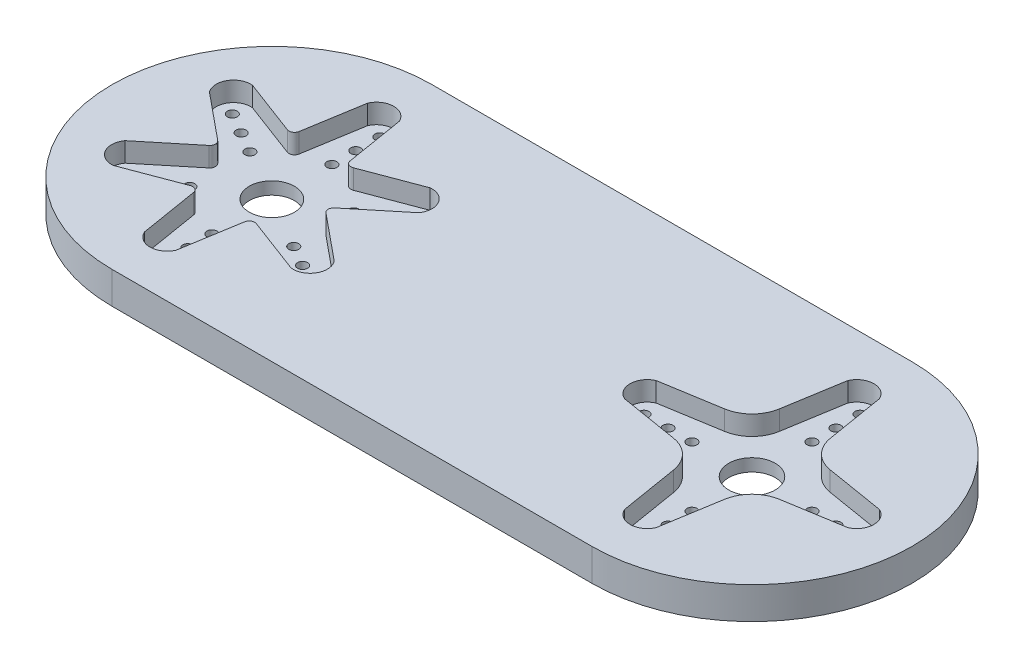
from build123d import *

# Parameters (mm, degrees)
BOSS_EXTRUDE1_DEPTH     = 4
SKETCH2_R               = 0.62500002
CUT_EXTRUDE1_DEPTH      = 2.44
CUT_EXTRUDE3_DEPTH      = 54.906897466
CUT_EXTRUDE3_DEPTH_BACK = 54.906897466
SKETCH3_R               = 0.62500002
SKETCH3_R_2             = 2.819999948
SKETCH3_R_3             = 2.899999788


with BuildPart() as part:
    # Sketch1 → Boss-Extrude1 (new body)
    with BuildSketch(Plane(origin=(0, 0, 0), x_dir=(1, 0, 0), z_dir=(0, 1, 0))):
        with BuildLine():
            Line((-29.999999944, 20), (29.999999944, 20))
            ThreePointArc((29.999999944, 20), (49.999999944, 0), (29.999999944, -20))
            Line((29.999999944, -20), (-29.999999944, -20))
            ThreePointArc((-29.999999944, -20), (-49.999999944, 0), (-29.999999944, 20))
        make_face()
    extrude(amount=BOSS_EXTRUDE1_DEPTH)

    # Sketch2 → Cut-Extrude1 (cut)
    # profile 1 of 2: a face of its own
    with BuildSketch(Plane(origin=(0, 4, 0), x_dir=(1, 0, 0), z_dir=(0, 1, 0))):
        with BuildLine():
            ThreePointArc((-25.922132216, 6.078589696), (-26.51895884, 6.127411318), (-26.859652917, 6.619867525))
            Line((-26.859652917, 6.619867525), (-28.07063938, 13.972272054))
            ThreePointArc((-28.07063938, 13.972272054), (-30.044051051, 15.261772506), (-32.017462722, 13.972272054))
            Line((-32.017462722, 13.972272054), (-33.228449185, 6.619867525))
            ThreePointArc((-33.228449185, 6.619867525), (-33.569143262, 6.127411318), (-34.165969886, 6.078589696))
            Line((-34.165969886, 6.078589696), (-41.138832219, 8.70604692))
            ThreePointArc((-41.138832219, 8.70604692), (-43.242278204, 7.641772507), (-43.112243889, 5.287997642))
            Line((-43.112243889, 5.287997642), (-37.35036802, 0.563050336))
            ThreePointArc((-37.35036802, 0.563050336), (-37.094235473, 0.021772507), (-37.35036802, -0.519505322))
            Line((-37.35036802, -0.519505322), (-43.112243889, -5.244452627))
            ThreePointArc((-43.112243889, -5.244452627), (-43.242278204, -7.598227492), (-41.138832218, -8.662501905))
            Line((-41.138832218, -8.662501905), (-34.165969886, -6.035044681))
            ThreePointArc((-34.165969886, -6.035044681), (-33.569143262, -6.083866304), (-33.228449185, -6.57632251))
            Line((-33.228449185, -6.57632251), (-32.017462722, -13.928727039))
            ThreePointArc((-32.017462722, -13.928727039), (-30.044051051, -15.218227491), (-28.07063938, -13.928727039))
            Line((-28.07063938, -13.928727039), (-26.859652917, -6.576322511))
            ThreePointArc((-26.859652917, -6.576322511), (-26.51895884, -6.083866304), (-25.922132216, -6.035044681))
            Line((-25.922132216, -6.035044681), (-18.949269883, -8.662501905))
            ThreePointArc((-18.949269883, -8.662501905), (-16.845823898, -7.598227492), (-16.975858213, -5.244452627))
            Line((-16.975858213, -5.244452627), (-22.737734082, -0.519505322))
            ThreePointArc((-22.737734082, -0.519505322), (-22.993866629, 0.021772507), (-22.737734082, 0.563050336))
            Line((-22.737734082, 0.563050336), (-16.975858213, 5.287997642))
            ThreePointArc((-16.975858213, 5.287997642), (-16.845823898, 7.641772507), (-18.949269884, 8.70604692))
            Line((-18.949269884, 8.70604692), (-25.922132216, 6.078589696))
        make_face()
    # profile 2 of 2: a face of its own
    with BuildSketch(Plane(origin=(0, 4, 0), x_dir=(1, 0, 0), z_dir=(0, 1, 0))):
        with BuildLine():
            ThreePointArc((33.184398078, -6.598095019), (34.342465035, -4.342465091), (36.598094963, -3.184398134))
            Line((36.598094963, -3.184398134), (43.950499492, -1.973411671))
            ThreePointArc((43.950499492, -1.973411671), (45.239999942, 1e-09), (43.950499491, 1.973411671))
            Line((43.950499491, 1.973411671), (36.598094963, 3.184398134))
            ThreePointArc((36.598094963, 3.184398134), (34.342465035, 4.342465091), (33.184398078, 6.598095019))
            Line((33.184398078, 6.598095019), (31.973411615, 13.950499548))
            ThreePointArc((31.973411615, 13.950499548), (29.999999943, 15.239999998), (28.026588273, 13.950499547))
            Line((28.026588273, 13.950499547), (26.81560181, 6.598095019))
            ThreePointArc((26.81560181, 6.598095019), (25.657534853, 4.342465091), (23.401904925, 3.184398134))
            Line((23.401904925, 3.184398134), (16.049500396, 1.973411671))
            ThreePointArc((16.049500396, 1.973411671), (14.759999946, -1e-09), (16.049500397, -1.973411671))
            Line((16.049500397, -1.973411671), (23.401904925, -3.184398134))
            ThreePointArc((23.401904925, -3.184398134), (25.657534853, -4.342465091), (26.81560181, -6.598095019))
            Line((26.81560181, -6.598095019), (28.026588273, -13.950499548))
            ThreePointArc((28.026588273, -13.950499548), (29.999999945, -15.239999998), (31.973411615, -13.950499547))
            Line((31.973411615, -13.950499547), (33.184398078, -6.598095019))
        make_face()
        with Locations((29.999999944, -13.500466522)):
            Circle(SKETCH2_R, mode=Mode.SUBTRACT)
        with Locations((29.999999944, -10.500466426)):
            Circle(SKETCH2_R, mode=Mode.SUBTRACT)
        with Locations((16.499533422, 0)):
            Circle(SKETCH2_R, mode=Mode.SUBTRACT)
        with Locations((19.499533518, 0)):
            Circle(SKETCH2_R, mode=Mode.SUBTRACT)
        with Locations((22.499533614, 0)):
            Circle(SKETCH2_R, mode=Mode.SUBTRACT)
        with Locations((29.999999944, -7.50046633)):
            Circle(SKETCH2_R, mode=Mode.SUBTRACT)
        with Locations((37.500466274, 0)):
            Circle(SKETCH2_R, mode=Mode.SUBTRACT)
        with Locations((40.50046637, 0)):
            Circle(SKETCH2_R, mode=Mode.SUBTRACT)
        with Locations((43.500466466, 0)):
            Circle(SKETCH2_R, mode=Mode.SUBTRACT)
        with Locations((29.999999944, 7.50046633)):
            Circle(SKETCH2_R, mode=Mode.SUBTRACT)
        with Locations((29.999999944, 10.500466426)):
            Circle(SKETCH2_R, mode=Mode.SUBTRACT)
        with Locations((29.999999944, 13.500466522)):
            Circle(SKETCH2_R, mode=Mode.SUBTRACT)
    extrude(amount=-CUT_EXTRUDE1_DEPTH, mode=Mode.SUBTRACT)

    # Sketch3 → Cut-Extrude3 (cut, two sides: drawn at the far end of the back side and taken through both)
    with BuildSketch(Plane(origin=(0, 1.56, 0), x_dir=(1, 0, 0), z_dir=(0, 1, 0)).offset(-CUT_EXTRUDE3_DEPTH_BACK)):
        with Locations((-30.044051051, 13.522239028)):
            Circle(SKETCH3_R)
        with Locations((-30.044051051, 10.522238932)):
            Circle(SKETCH3_R)
        with Locations((-30.044051051, 7.522238836)):
            Circle(SKETCH3_R)
        with Locations((-23.548456669, 3.772005671)):
            Circle(SKETCH3_R)
        with Locations((-20.950380374, 5.272005719)):
            Circle(SKETCH3_R)
        with Locations((-18.35230408, 6.772005767)):
            Circle(SKETCH3_R)
        with Locations((-23.548456669, -3.728460659)):
            Circle(SKETCH3_R)
        with Locations((-20.950380374, -5.228460707)):
            Circle(SKETCH3_R)
        with Locations((-18.35230408, -6.728460755)):
            Circle(SKETCH3_R)
        with Locations((-30.044051051, -7.478693824)):
            Circle(SKETCH3_R)
        with Locations((-30.044051051, -10.47869392)):
            Circle(SKETCH3_R)
        with Locations((-30.044051051, -13.478694016)):
            Circle(SKETCH3_R)
        with Locations((-36.539645433, -3.728460659)):
            Circle(SKETCH3_R)
        with Locations((-39.137721727, -5.228460707)):
            Circle(SKETCH3_R)
        with Locations((-41.735798022, -6.728460755)):
            Circle(SKETCH3_R)
        with Locations((-36.539645433, 3.772005671)):
            Circle(SKETCH3_R)
        with Locations((-39.137721727, 5.272005719)):
            Circle(SKETCH3_R)
        with Locations((-41.735798022, 6.772005767)):
            Circle(SKETCH3_R)
        with Locations((-30.044051051, 0.021772506)):
            Circle(SKETCH3_R_2)
        with Locations((29.999999944, 0)):
            Circle(SKETCH3_R_3)
        with Locations((29.999999944, 7.50046633)):
            Circle(SKETCH3_R)
        with Locations((29.999999944, 10.500466426)):
            Circle(SKETCH3_R)
        with Locations((29.999999944, 13.500466522)):
            Circle(SKETCH3_R)
        with Locations((16.499533422, 0)):
            Circle(SKETCH3_R)
        with Locations((19.499533518, 0)):
            Circle(SKETCH3_R)
        with Locations((22.499533614, 0)):
            Circle(SKETCH3_R)
        with Locations((29.999999944, -13.500466522)):
            Circle(SKETCH3_R)
        with Locations((29.999999944, -10.500466426)):
            Circle(SKETCH3_R)
        with Locations((29.999999944, -7.50046633)):
            Circle(SKETCH3_R)
        with Locations((43.500466466, 0)):
            Circle(SKETCH3_R)
        with Locations((40.50046637, 0)):
            Circle(SKETCH3_R)
        with Locations((37.500466274, 0)):
            Circle(SKETCH3_R)
    extrude(amount=CUT_EXTRUDE3_DEPTH + CUT_EXTRUDE3_DEPTH_BACK, mode=Mode.SUBTRACT)


solid = part.part
